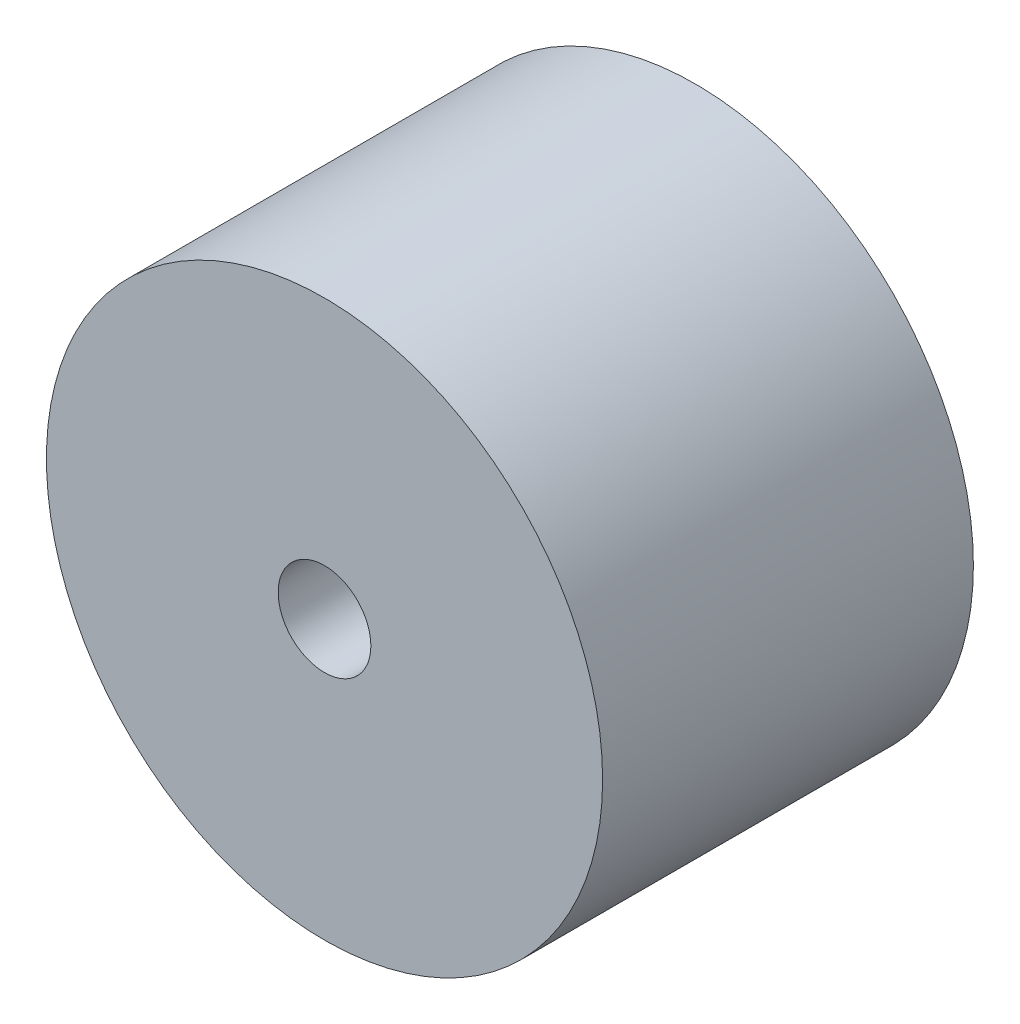
from build123d import *

# Parameters (mm, degrees)
SKETCH_1_R      = 18
SKETCH_1_R_2    = 3
EXTRUDE_1_DEPTH = 24


with BuildPart() as part:
    # 草图1 → 凸台-拉伸1 (new body)
    with BuildSketch(Plane.XY):
        Circle(SKETCH_1_R)
        Circle(SKETCH_1_R_2, mode=Mode.SUBTRACT)
    extrude(amount=EXTRUDE_1_DEPTH)


solid = part.part
